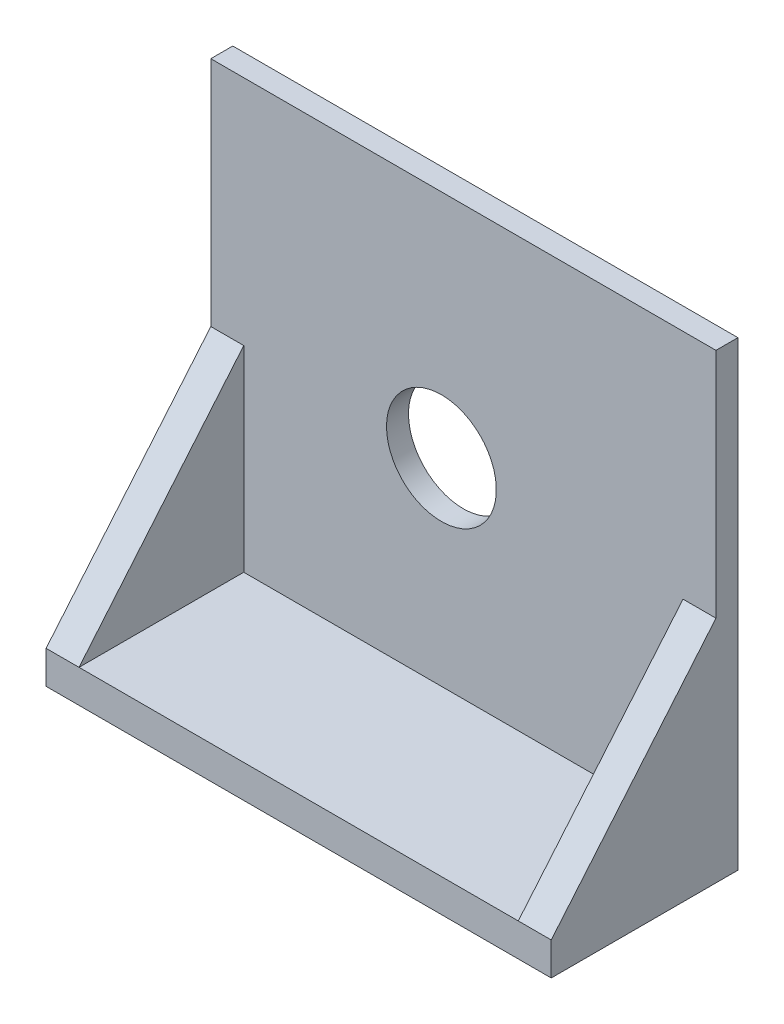
from build123d import *

# Parameters (mm, degrees)
SKETCH1_W           = 46
SKETCH1_H           = 42
BOSS_EXTRUDE1_DEPTH = 2
SKETCH2_W           = 46
SKETCH2_H           = 3
BOSS_EXTRUDE2_DEPTH = 15
SKETCH4_R           = 5
CUT_EXTRUDE2_DEPTH  = 2
BOSS_EXTRUDE3_DEPTH = 3
BOSS_EXTRUDE4_DEPTH = 3


with BuildPart() as part:
    # Sketch1 → Boss-Extrude1 (new body)
    with BuildSketch(Plane.XY):
        with Locations((23, -21)):
            Rectangle(SKETCH1_W, SKETCH1_H)
    extrude(amount=BOSS_EXTRUDE1_DEPTH)

    # Sketch2 → Boss-Extrude2 (add)
    with BuildSketch(Plane.XY.offset(2)):
        with Locations((23, -40.5)):
            Rectangle(SKETCH2_W, SKETCH2_H)
    extrude(amount=BOSS_EXTRUDE2_DEPTH)

    # Sketch4 → Cut-Extrude2 (cut)
    with BuildSketch(Plane(origin=(0, 0, 0), x_dir=(-1, 0, 0), z_dir=(0, 0, -1))):
        with Locations((-21, -21)):
            Circle(SKETCH4_R)
    extrude(amount=-CUT_EXTRUDE2_DEPTH, mode=Mode.SUBTRACT)

    # Sketch5 → Boss-Extrude3 (add)
    with BuildSketch(Plane.ZY):
        Polygon((17, -39), (2, -21.123696111), (2, -39), align=None)
    extrude(amount=-BOSS_EXTRUDE3_DEPTH)

    # Sketch6 → Boss-Extrude4 (add)
    with BuildSketch(Plane(origin=(46, 0, 0), x_dir=(0, 0, -1), z_dir=(1, 0, 0))):
        Polygon((-17, -39), (-2, -21.123696111), (-2, -39), align=None)
    extrude(amount=-BOSS_EXTRUDE4_DEPTH)


solid = part.part
